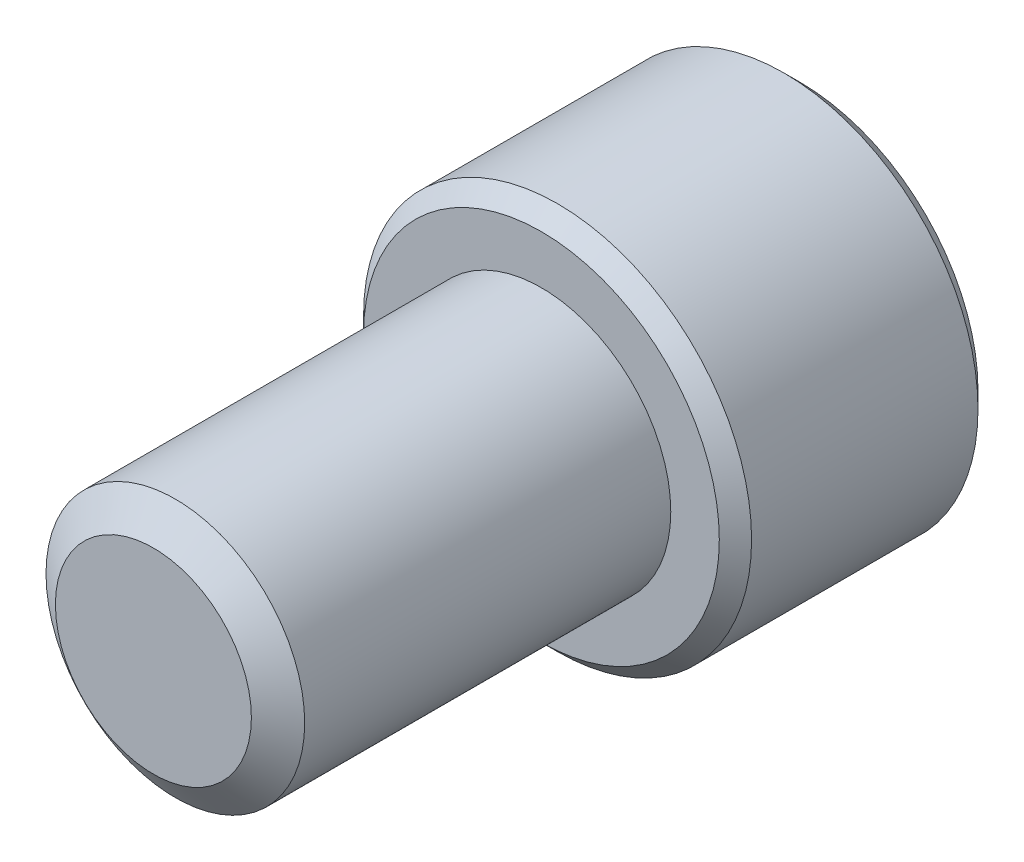
from build123d import *

# Parameters (mm, degrees)
SKETCH1_R           = 3.175
BOSS_EXTRUDE1_DEPTH = 9.525
SKETCH3_R           = 4.7625
BOSS_EXTRUDE2_DEPTH = 6.35
CUT_EXTRUDE1_START  = -6.35
CUT_EXTRUDE1_DEPTH  = 3.571875
CHAMFER1_SIZE       = 0.39624


with BuildPart() as part:
    # Sketch1 → Boss-Extrude1 (new body)
    with BuildSketch(Plane.XY):
        with Locations(Location((0, 0, 0), (0, 0, 180))):
            Circle(SKETCH1_R)
    extrude(amount=BOSS_EXTRUDE1_DEPTH)

    # Sketch2 → Cut-Revolve1 (revolve, cut)
    with BuildSketch(Plane(origin=(0, 0, 0), x_dir=(0, 0, -1), z_dir=(1, 0, 0)), mode=Mode.PRIVATE) as cut_revolve1_sk:
        Polygon((-9.525, 3.175), (-9.525, 2.405444262), (-8.986151271, 3.175), align=None)
    revolve(cut_revolve1_sk.sketch.rotate(Axis((0, 0, 0), (0, 0, 1)), 90), axis=Axis((0, 0, 0), (0, 0, 1)), mode=Mode.SUBTRACT)

    # Sketch3 → Boss-Extrude2 (add)
    with BuildSketch(Plane.XY):
        Circle(SKETCH3_R)
    extrude(amount=-BOSS_EXTRUDE2_DEPTH)

    # Sketch4 → Cut-Extrude1 (cut)
    with BuildSketch(Plane.XY.offset(CUT_EXTRUDE1_START)):
        Polygon((0, -2.749630657), (2.38125, -1.374815329), (2.38125, 1.374815329), (0, 2.749630657), (-2.38125, 1.374815329), (-2.38125, -1.374815329), align=None)
    extrude(amount=CUT_EXTRUDE1_DEPTH, mode=Mode.SUBTRACT)

    # Cut-Extrude2 cone 1 section (through the dimple's axis) → Cut-Extrude2 (revolve, cut)
    with BuildSketch(Plane(origin=(0, 0, -6.35), x_dir=(0, 1, 0), z_dir=(1, 0, 0))):
        Polygon((0, 0), (2.749630657, 0), (0, 2.749630657), align=None)
    revolve(axis=Axis((0, 0, -6.35), (0, 0, 1)), mode=Mode.SUBTRACT)

    # Chamfer1
    chamfer1_edges = [part.edges().sort_by_distance(p)[0] for p in [
        (-4.7625, 0, -6.35),
        (-4.7625, 0, 0),
    ]]
    chamfer(chamfer1_edges, length=CHAMFER1_SIZE)


solid = part.part
